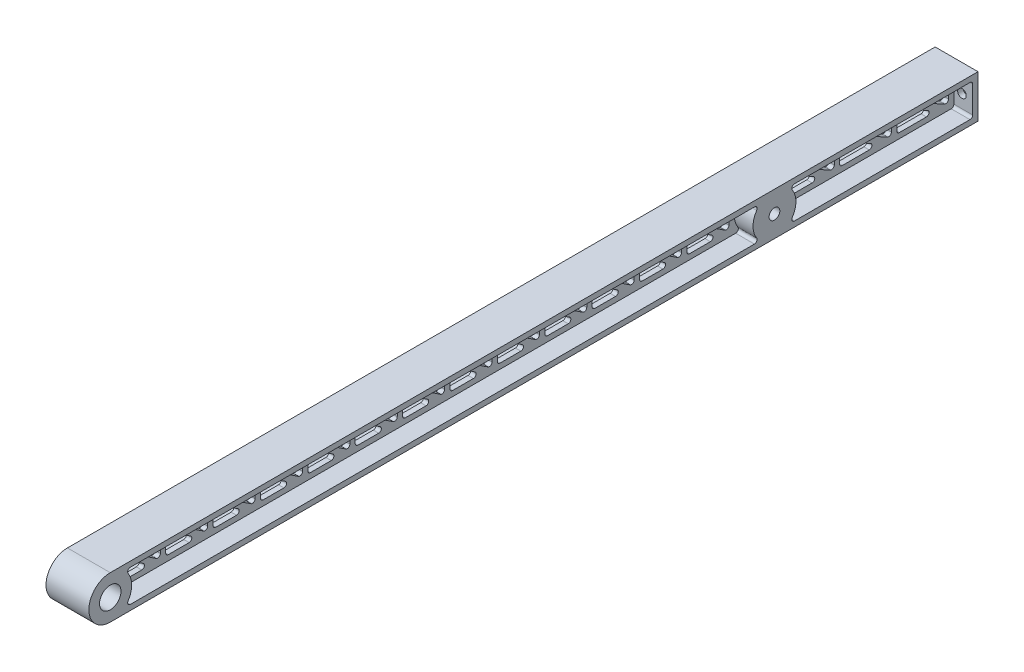
from build123d import *

# Parameters (mm, degrees)
SKETCH1_R                   = 6.35
BOSS_EXTRUDE1_DEPTH         = 25.4
F_1_4_20_TAPPED_HOLE1_D     = 5.1054
F_1_4_20_TAPPED_HOLE1_DEPTH = 16.51
F_1_4_20_TAPPED_HOLE1_TIP   = 1.533816902
SKETCH4_R                   = 3.175
CUT_EXTRUDE1_DEPTH          = 38.1
CUT_EXTRUDE2_START          = -11.1125
CUT_EXTRUDE2_DEPTH          = 11.1125
CUT_EXTRUDE3_DEPTH          = 515.705105042
FILLET1_R                   = 1.5875


with BuildPart() as part:
    # Sketch1 → Boss-Extrude1 (new body)
    with BuildSketch(Plane(origin=(0, 0, 0), x_dir=(0, 0, -1), z_dir=(1, 0, 0))):
        with BuildLine():
            Line((0, 12.7), (514.35, 12.7))
            Line((514.35, 12.7), (514.35, -12.7))
            Line((514.35, -12.7), (0, -12.7))
            ThreePointArc((0, -12.7), (-12.7, 0), (0, 12.7))
        make_face()
        Circle(SKETCH1_R, mode=Mode.SUBTRACT)
    extrude(amount=BOSS_EXTRUDE1_DEPTH)

    # 1/4-20 Tapped Hole1
    with Locations(Plane(origin=(0, 0, -514.35), x_dir=(-1, 0, 0), z_dir=(0, 0, -1))):
        with Locations((-6.35, 0), (-19.05, 0)):
            Hole(F_1_4_20_TAPPED_HOLE1_D / 2, depth=F_1_4_20_TAPPED_HOLE1_DEPTH)
            with Locations((0, 0, -(F_1_4_20_TAPPED_HOLE1_DEPTH + F_1_4_20_TAPPED_HOLE1_TIP / 2))):  # 118° drill point
                Cone(0, F_1_4_20_TAPPED_HOLE1_D / 2, F_1_4_20_TAPPED_HOLE1_TIP, mode=Mode.SUBTRACT)

    # Sketch4 → Cut-Extrude1 (cut)
    with BuildSketch(Plane(origin=(25.4, 0, 0), x_dir=(0, 0, -1), z_dir=(1, 0, 0))):
        with Locations((393.7, 0)):
            Circle(SKETCH4_R)
    extrude(amount=-CUT_EXTRUDE1_DEPTH, mode=Mode.SUBTRACT)

    # Sketch19 → Cut-Extrude2 (cut)
    with BuildSketch(Plane(origin=(25.4, 0, 0), x_dir=(0, 0, -1), z_dir=(1, 0, 0)).offset(CUT_EXTRUDE2_START)):
        with BuildLine():
            Line((385.299739587, 9.525), (8.400260413, 9.525))
            ThreePointArc((8.400260413, 9.525), (12.7, 0), (8.400260413, -9.525))
            Line((8.400260413, -9.525), (385.299739587, -9.525))
            ThreePointArc((385.299739587, -9.525), (381, 0), (385.299739587, 9.525))
        make_face()
        with BuildLine():
            Line((511.175, 9.525), (402.100260413, 9.525))
            ThreePointArc((402.100260413, 9.525), (406.4, 0), (402.100260413, -9.525))
            Line((402.100260413, -9.525), (511.175, -9.525))
            Line((511.175, -9.525), (511.175, 9.525))
        make_face()
    cut_extrude2 = extrude(amount=CUT_EXTRUDE2_DEPTH, mode=Mode.SUBTRACT)

    # Sketch21 → Cut-Extrude3 (cut, through all)
    with BuildSketch(Plane(origin=(14.2875, 0, 0), x_dir=(0, 0, -1), z_dir=(1, 0, 0))):
        Polygon((15.875, -6.35), (35.038992251, -6.35), (15.875, 6.35), align=None)
        Polygon((40.786538462, 6.35), (40.786538462, -6.35), (21.62254621, 6.35), align=None)
        Polygon((43.961538462, -6.35), (63.125530713, -6.35), (43.961538462, 6.35), align=None)
        Polygon((68.873076923, 6.35), (68.873076923, -6.35), (49.709084672, 6.35), align=None)
        Polygon((72.048076923, -6.35), (91.212069174, -6.35), (72.048076923, 6.35), align=None)
        Polygon((96.959615385, 6.35), (96.959615385, -6.35), (77.795623133, 6.35), align=None)
        Polygon((100.134615385, -6.35), (119.298607636, -6.35), (100.134615385, 6.35), align=None)
        Polygon((125.046153846, 6.35), (125.046153846, -6.35), (105.882161595, 6.35), align=None)
        Polygon((128.221153846, -6.35), (147.385146098, -6.35), (128.221153846, 6.35), align=None)
        Polygon((153.132692308, 6.35), (153.132692308, -6.35), (133.968700056, 6.35), align=None)
        Polygon((156.307692308, -6.35), (175.471684559, -6.35), (156.307692308, 6.35), align=None)
        Polygon((181.219230769, 6.35), (181.219230769, -6.35), (162.055238518, 6.35), align=None)
        Polygon((184.394230769, -6.35), (203.558223021, -6.35), (184.394230769, 6.35), align=None)
        Polygon((209.305769231, 6.35), (209.305769231, -6.35), (190.141776979, 6.35), align=None)
        Polygon((212.480769231, -6.35), (231.644761482, -6.35), (212.480769231, 6.35), align=None)
        Polygon((237.392307692, 6.35), (237.392307692, -6.35), (218.228315441, 6.35), align=None)
        Polygon((240.567307692, -6.35), (259.731299944, -6.35), (240.567307692, 6.35), align=None)
        Polygon((265.478846154, 6.35), (265.478846154, -6.35), (246.314853902, 6.35), align=None)
        Polygon((268.653846154, -6.35), (287.817838405, -6.35), (268.653846154, 6.35), align=None)
        Polygon((293.565384615, 6.35), (293.565384615, -6.35), (274.401392364, 6.35), align=None)
        Polygon((296.740384615, -6.35), (315.904376867, -6.35), (296.740384615, 6.35), align=None)
        Polygon((321.651923077, 6.35), (321.651923077, -6.35), (302.487930826, 6.35), align=None)
        Polygon((324.826923077, -6.35), (343.990915328, -6.35), (324.826923077, 6.35), align=None)
        Polygon((349.738461538, 6.35), (349.738461538, -6.35), (330.574469287, 6.35), align=None)
        Polygon((352.913461538, -6.35), (372.07745379, -6.35), (352.913461538, 6.35), align=None)
        Polygon((377.825, 6.35), (377.825, -6.35), (358.661007749, 6.35), align=None)
        Polygon((409.575, -6.35), (433.495873699, -6.35), (409.575, 6.35), align=None)
        Polygon((440.266666667, -6.35), (440.266666667, 6.35), (416.345792967, 6.35), align=None)
        Polygon((443.441666667, -6.35), (467.362540366, -6.35), (443.441666667, 6.35), align=None)
        Polygon((474.133333333, -6.35), (474.133333333, 6.35), (450.212459634, 6.35), align=None)
        Polygon((477.308333333, -6.35), (501.229207033, -6.35), (477.308333333, 6.35), align=None)
        Polygon((508, -6.35), (508, 6.35), (484.079126301, 6.35), align=None)
    extrude(amount=-CUT_EXTRUDE3_DEPTH, mode=Mode.SUBTRACT)

    # Mirror2: Cut-Extrude2 across plane
    add(cut_extrude2.mirror(Plane.ZY.offset(-12.7)), mode=Mode.SUBTRACT)

    # Fillet1
    fillet1_edges = [part.edges().sort_by_distance(p)[0] for p in [
        (19.84375, 9.525, -385.299739587),
        (19.84375, -9.525, -385.299739587),
        (19.84375, -9.525, -8.400260413),
        (19.84375, 9.525, -8.400260413),
        (12.7, 6.35, -358.661007749),
        (12.7, 6.35, -377.825),
        (12.7, -6.35, -377.825),
        (12.7, 6.35, -352.913461538),
        (12.7, -6.35, -372.07745379),
        (12.7, -6.35, -352.913461538),
        (12.7, 6.35, -330.574469287),
        (12.7, 6.35, -349.738461538),
        (12.7, -6.35, -349.738461538),
        (12.7, 6.35, -324.826923077),
        (12.7, -6.35, -343.990915328),
        (12.7, -6.35, -324.826923077),
        (12.7, 6.35, -302.487930826),
        (12.7, 6.35, -321.651923077),
        (12.7, -6.35, -321.651923077),
        (12.7, 6.35, -296.740384615),
        (12.7, -6.35, -315.904376867),
        (12.7, -6.35, -296.740384615),
        (12.7, 6.35, -274.401392364),
        (12.7, 6.35, -293.565384615),
        (12.7, -6.35, -293.565384615),
        (12.7, 6.35, -268.653846154),
        (12.7, -6.35, -287.817838405),
        (12.7, -6.35, -268.653846154),
        (12.7, 6.35, -246.314853902),
        (12.7, 6.35, -265.478846154),
        (12.7, -6.35, -265.478846154),
        (12.7, 6.35, -240.567307692),
        (12.7, -6.35, -259.731299944),
        (12.7, -6.35, -240.567307692),
        (12.7, 6.35, -218.228315441),
        (12.7, 6.35, -237.392307692),
        (12.7, -6.35, -237.392307692),
        (12.7, 6.35, -212.480769231),
        (12.7, -6.35, -231.644761482),
        (12.7, -6.35, -212.480769231),
        (12.7, 6.35, -190.141776979),
        (12.7, 6.35, -209.305769231),
        (12.7, -6.35, -209.305769231),
        (12.7, 6.35, -184.394230769),
        (12.7, -6.35, -203.558223021),
        (12.7, -6.35, -184.394230769),
        (12.7, 6.35, -162.055238518),
        (12.7, 6.35, -181.219230769),
        (12.7, -6.35, -181.219230769),
        (12.7, 6.35, -156.307692308),
        (12.7, -6.35, -175.471684559),
        (12.7, -6.35, -156.307692308),
        (12.7, 6.35, -133.968700056),
        (12.7, 6.35, -153.132692308),
        (12.7, -6.35, -153.132692308),
        (12.7, 6.35, -128.221153846),
        (12.7, -6.35, -147.385146098),
        (12.7, -6.35, -128.221153846),
        (12.7, 6.35, -105.882161595),
        (12.7, 6.35, -125.046153846),
        (12.7, -6.35, -125.046153846),
        (12.7, 6.35, -100.134615385),
        (12.7, -6.35, -119.298607636),
        (12.7, -6.35, -100.134615385),
        (19.84375, 9.525, -511.175),
        (12.7, 6.35, -77.795623133),
        (12.7, 6.35, -96.959615385),
        (12.7, -6.35, -96.959615385),
        (12.7, 6.35, -72.048076923),
        (12.7, -6.35, -91.212069174),
        (12.7, -6.35, -72.048076923),
        (19.84375, -9.525, -402.100260413),
        (12.7, 6.35, -49.709084672),
        (12.7, 6.35, -68.873076923),
        (12.7, -6.35, -68.873076923),
        (12.7, 6.35, -43.961538462),
        (12.7, -6.35, -63.125530713),
        (12.7, -6.35, -43.961538462),
        (19.84375, 9.525, -402.100260413),
        (12.7, 6.35, -21.62254621),
        (12.7, 6.35, -40.786538462),
        (12.7, -6.35, -40.786538462),
        (12.7, 6.35, -15.875),
        (12.7, -6.35, -35.038992251),
        (12.7, -6.35, -15.875),
        (19.84375, -9.525, -511.175),
        (5.55625, -9.525, -385.299739587),
        (5.55625, 9.525, -385.299739587),
        (5.55625, 9.525, -8.400260413),
        (5.55625, -9.525, -8.400260413),
        (12.7, 6.35, -484.079126301),
        (12.7, 6.35, -508),
        (12.7, -6.35, -508),
        (12.7, 6.35, -477.308333333),
        (12.7, -6.35, -501.229207033),
        (12.7, -6.35, -477.308333333),
        (12.7, 6.35, -450.212459634),
        (12.7, 6.35, -474.133333333),
        (12.7, -6.35, -474.133333333),
        (12.7, 6.35, -443.441666667),
        (12.7, -6.35, -467.362540366),
        (12.7, -6.35, -443.441666667),
        (12.7, 6.35, -416.345792967),
        (12.7, 6.35, -440.266666667),
        (12.7, -6.35, -440.266666667),
        (12.7, 6.35, -409.575),
        (12.7, -6.35, -433.495873699),
        (12.7, -6.35, -409.575),
        (5.55625, -9.525, -511.175),
        (5.55625, 9.525, -402.100260413),
        (5.55625, -9.525, -402.100260413),
        (5.55625, 9.525, -511.175),
    ]]
    fillet(fillet1_edges, radius=FILLET1_R)


solid = part.part
